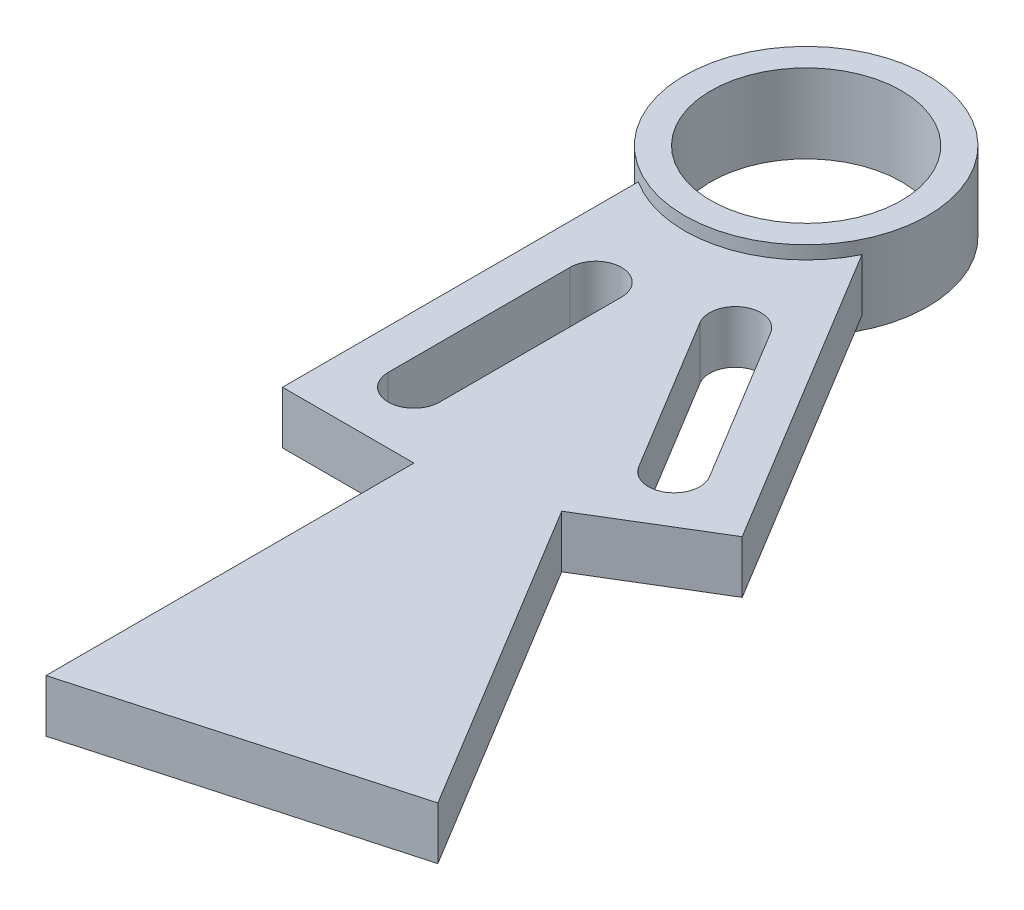
from build123d import *

# Parameters (mm, degrees)
SKETCH1_R             = 11.5062
BEARING_EXTRUDE_DEPTH = 4.7625
BOSS_EXTRUDE2_DEPTH   = 3.175


with BuildPart() as part:
    # Sketch1 → Bearing extrude (new, symmetric)
    with BuildSketch(Plane(origin=(0, 0, 0), x_dir=(1, 0, 0), z_dir=(0, 1, 0))):
        with BuildLine():
            ThreePointArc((14.6812, 0), (-7.035822924, 12.885450292), (-7.9375, -12.350454534))
            ThreePointArc((-7.9375, -12.350454534), (3.951379748, -14.13945655), (13.190345938, -6.446115688))
            ThreePointArc((13.190345938, -6.446115688), (14.303631361, -3.308135929), (14.6812, 0))
        make_face()
        Circle(SKETCH1_R, mode=Mode.SUBTRACT)
    extrude(amount=BEARING_EXTRUDE_DEPTH, both=True)

    # Sketch1<5> → Boss-Extrude2 (add, symmetric)
    with BuildSketch(Plane(origin=(0, 0, 0), x_dir=(1, 0, 0), z_dir=(0, 1, 0))):
        with BuildLine():
            Line((-7.9375, -12.350454534), (-7.9375, -55.3212))
            Line((-7.9375, -55.3212), (7.9375, -55.3212))
            Line((7.9375, -55.3212), (7.9375, -99.7712))
            Line((7.9375, -99.7712), (44.936648924, -89.431503617))
            Line((44.936648924, -89.431503617), (21.89252839, -51.421360118))
            Line((21.89252839, -51.421360118), (28.680054014, -47.306338594))
            Line((28.680054014, -47.306338594), (35.467579639, -43.19131707))
            Line((35.467579639, -43.19131707), (13.190345938, -6.446115688))
            ThreePointArc((13.190345938, -6.446115688), (3.951379748, -14.13945655), (-7.9375, -12.350454534))
        make_face()
        with BuildLine():
            ThreePointArc((3.1115, -47.3837), (0, -50.4952), (-3.1115, -47.3837))
            Line((-3.1115, -47.3837), (-3.1115, -25.4127))
            ThreePointArc((-3.1115, -25.4127), (0, -22.3012), (3.1115, -25.4127))
            Line((3.1115, -25.4127), (3.1115, -47.3837))
        make_face(mode=Mode.SUBTRACT)
        with BuildLine():
            ThreePointArc((27.225742535, -38.905724532), (27.587064378, -41.259593312), (26.178120928, -43.179523014))
            ThreePointArc((26.178120928, -43.179523014), (23.824252147, -43.540844858), (21.904322445, -42.131901407))
            Line((21.904322445, -42.131901407), (10.513942867, -23.344030478))
            ThreePointArc((10.513942867, -23.344030478), (11.561564474, -19.070231995), (15.835362956, -20.117853603))
            Line((15.835362956, -20.117853603), (27.225742535, -38.905724532))
        make_face(mode=Mode.SUBTRACT)
    extrude(amount=BOSS_EXTRUDE2_DEPTH, both=True)


solid = part.part
